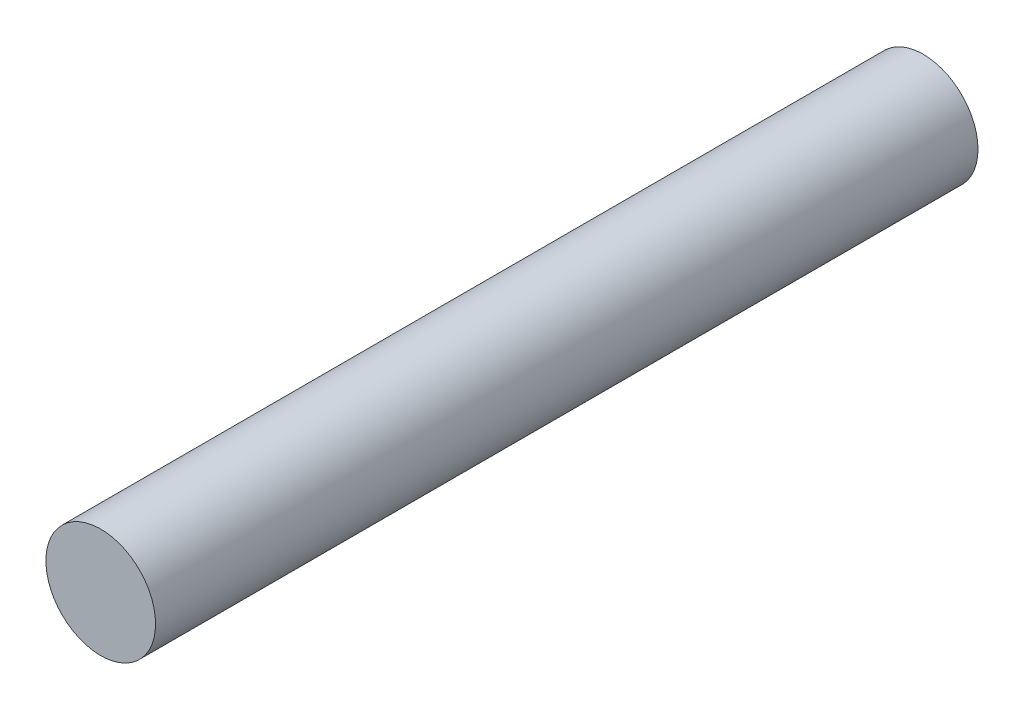
from build123d import *

# Parameters (mm, degrees)
SKETCH1_R           = 25.4
BOSS_EXTRUDE1_DEPTH = 381


with BuildPart() as part:
    # Sketch1 → Boss-Extrude1 (new body)
    with BuildSketch(Plane.XY):
        Circle(SKETCH1_R)
    extrude(amount=BOSS_EXTRUDE1_DEPTH)


solid = part.part
